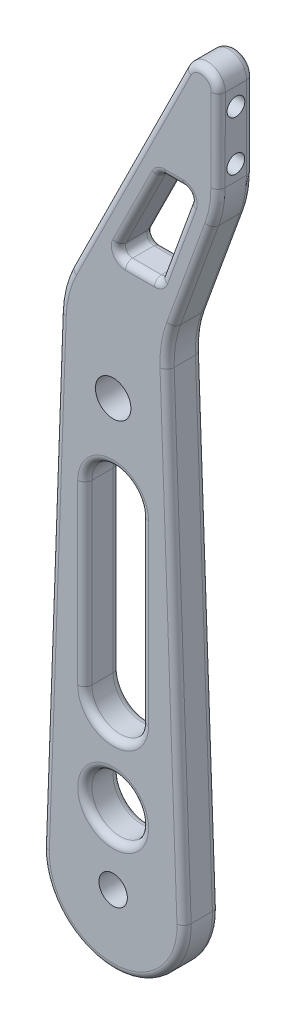
from build123d import *

# Parameters (mm, degrees)
SKETCH1_R           = 4
SKETCH1_R_2         = 8
SKETCH1_R_3         = 5
BOSS_EXTRUDE1_DEPTH = 10
FILLET1_R           = 5
FILLET2_R           = 30
SKETCH2_R           = 2.5
CUT_EXTRUDE1_DEPTH  = 21
FILLET3_R           = 2


with BuildPart() as part:
    # Sketch1 → Boss-Extrude1 (new body)
    with BuildSketch(Plane.XY):
        with BuildLine():
            Line((-15, 140), (-19.987191738, 0.715658028))
            ThreePointArc((-19.987191738, 0.715658028), (0, -20), (19.987191738, 0.715658028))
            Line((19.987191738, 0.715658028), (15, 140))
            Line((15, 140), (29.558809371, 180))
            Line((29.558809371, 180), (29.698194676, 229.999805717))
            Line((29.698194676, 229.999805717), (-15, 140))
        make_face()
        Circle(SKETCH1_R, mode=Mode.SUBTRACT)
        with Locations((0, 20)):
            Circle(SKETCH1_R_2, mode=Mode.SUBTRACT)
        with Locations((0, 120)):
            Circle(SKETCH1_R_3, mode=Mode.SUBTRACT)
        with BuildLine():
            Line((8, 95), (8, 45))
            ThreePointArc((8, 45), (0, 37), (-8, 45))
            Line((-8, 45), (-8, 95))
            ThreePointArc((-8, 95), (0, 103), (8, 95))
        make_face(mode=Mode.SUBTRACT)
        Polygon((0.265486875, 155), (13.299379538, 181.243740176), (22.562249366, 181.243740176), (13.010309107, 155), align=None, mode=Mode.SUBTRACT)
    extrude(amount=BOSS_EXTRUDE1_DEPTH)

    # Fillet1
    fillet1_edges = [part.edges().sort_by_distance(p)[0] for p in [
        (29.698194676, 229.999805717, 5),
    ]]
    fillet(fillet1_edges, radius=FILLET1_R)

    # Fillet2
    fillet2_edges = [part.edges().sort_by_distance(p)[0] for p in [
        (29.558809371, 180, 5),
        (15, 140, 5),
        (-15, 140, 5),
    ]]
    fillet(fillet2_edges, radius=FILLET2_R)

    # Sketch2 → Cut-Extrude1 (cut)
    with BuildSketch(Plane(origin=(29.05679451, -0.081002118, 0), x_dir=(0, 0, -1), z_dir=(0.9999961143397721, -0.0027877061103215297, 0))):
        with Locations(Location((-5, 203.639108577, 0), (0, 0, 90))):
            Circle(SKETCH2_R)
        with Locations(Location((-5, 189.639108577, 0), (0, 0, 90))):
            Circle(SKETCH2_R)
    extrude(amount=-CUT_EXTRUDE1_DEPTH, mode=Mode.SUBTRACT)

    # Fillet3
    fillet3_edges = [part.edges().sort_by_distance(p)[0] for p in [
        (0, -20, 10),
        (17.598174454, 67.437115277, 10),
        (0, 103, 0),
        (-8, 70, 0),
        (0, 37, 0),
        (8, 70, 0),
        (0, 103, 10),
        (-8, 70, 10),
        (0, 37, 10),
        (8, 70, 10),
        (6.637897991, 155, 0),
        (0.265486875, 155, 5),
        (17.786279237, 168.121870088, 0),
        (13.010309107, 155, 5),
        (17.930814452, 181.243740176, 0),
        (22.562249366, 181.243740176, 5),
        (6.782433207, 168.121870088, 0),
        (13.299379538, 181.243740176, 5),
        (6.637897991, 155, 10),
        (17.786279237, 168.121870088, 10),
        (17.930814452, 181.243740176, 10),
        (6.782433207, 168.121870088, 10),
        (-8, 20, 0),
        (-8, 20, 10),
        (4.02032208, 178.297414565, 0),
        (4.02032208, 178.297414565, 10),
        (25.787451866, 213.437420494, 0),
        (25.787451866, 213.437420494, 10),
        (29.605927334, 196.901989807, 0),
        (29.605927334, 196.901989807, 10),
        (22.381748494, 160.281187303, 0),
        (-17.609450467, 67.122194159, 0),
        (-14.330306842, 139.830157025, 0),
        (29.110494892, 180.079694411, 0),
        (17.598174454, 67.437115277, 0),
        (22.381748494, 160.281187303, 10),
        (-17.609450467, 67.122194159, 10),
        (-14.330306842, 139.830157025, 10),
        (29.110494892, 180.079694411, 10),
        (0, -20, 0),
        (15.557223234, 139.911996951, 0),
        (15.557223234, 139.911996951, 10),
    ]]
    fillet(fillet3_edges, radius=FILLET3_R)


solid = part.part
